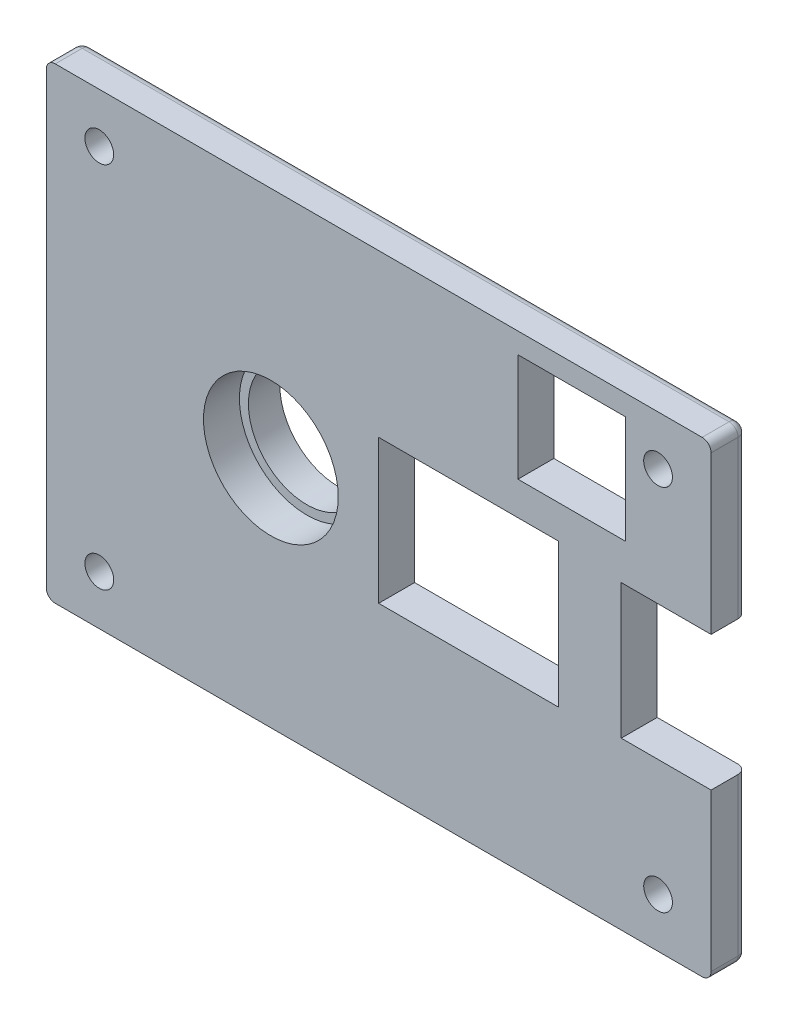
from build123d import *

# Parameters (mm, degrees)
ENCLOSURE_TOP_SKETCH_W          = 74
ENCLOSURE_TOP_SKETCH_H          = 52
ENCLOSURE_TOP_FEATURE_DEPTH     = 4
SCREW_HOLES_SKETCH_R            = 1.6
SCREW_HOLES_FEATURE_DEPTH       = 46.398237851
CAMERA_LIGHT_HOLE_SKETCH_R      = 7.5
CAMERA_LIGHT_HOLE_SKETCH_W      = 20
CAMERA_LIGHT_HOLE_SKETCH_H      = 16
CAMERA_LIGHT_HOLE_SKETCH_W_2    = 10
CAMERA_LIGHT_HOLE_SKETCH_H_2    = 15
CAMERA_LIGHT_HOLE_SKETCH_W_3    = 12
CAMERA_LIGHT_HOLE_SKETCH_H_3    = 12
CAMERA_LIGHT_HOLE_FEATURE_DEPTH = 46.398237851
FILTER_COVER_SKETCH_R           = 9
FILTER_COVER_FEATURE_DEPTH      = 3.5
FILTER_CUT_SKETCH_R             = 6.5
FILTER_CUT_DEPTH                = 3.5
FILLET1_R                       = 1
FILLET2_R                       = 1
FILLET3_R                       = 1
FILLET4_R                       = 1
FILLET5_R                       = 1
FILLET6_R                       = 1


with BuildPart() as part:
    # Enclosure Top Sketch → Enclosure Top Feature (new body)
    with BuildSketch(Plane.XY):
        Rectangle(ENCLOSURE_TOP_SKETCH_W, ENCLOSURE_TOP_SKETCH_H)
    extrude(amount=ENCLOSURE_TOP_FEATURE_DEPTH)

    # Screw Holes Sketch → Screw Holes Feature (cut, through all)
    with BuildSketch(Plane.XY.offset(4)):
        with Locations((-31.1, 20.5)):
            Circle(SCREW_HOLES_SKETCH_R)
        with Locations((31.096, 20.5)):
            Circle(SCREW_HOLES_SKETCH_R)
        with Locations((31.1, -20.5)):
            Circle(SCREW_HOLES_SKETCH_R)
        with Locations((-31.096, -20.5)):
            Circle(SCREW_HOLES_SKETCH_R)
    extrude(amount=-SCREW_HOLES_FEATURE_DEPTH, mode=Mode.SUBTRACT)

    # Camera + Light Hole Sketch → Camera _ Light Hole Feature (cut, through all)
    with BuildSketch(Plane.XY.offset(4)):
        with Locations((-12, 0)):
            Circle(CAMERA_LIGHT_HOLE_SKETCH_R)
        with Locations((10, 0)):
            Rectangle(CAMERA_LIGHT_HOLE_SKETCH_W, CAMERA_LIGHT_HOLE_SKETCH_H)
        with Locations((32, 0)):
            Rectangle(CAMERA_LIGHT_HOLE_SKETCH_W_2, CAMERA_LIGHT_HOLE_SKETCH_H_2)
        with Locations((21.5, 17.714)):
            Rectangle(CAMERA_LIGHT_HOLE_SKETCH_W_3, CAMERA_LIGHT_HOLE_SKETCH_H_3)
    extrude(amount=-CAMERA_LIGHT_HOLE_FEATURE_DEPTH, mode=Mode.SUBTRACT)

    # Filter Cover Sketch → Filter Cover Feature (add)
    with BuildSketch(Plane(origin=(0, 0, 0), x_dir=(-1, 0, 0), z_dir=(0, 0, -1))):
        with Locations(Location((12, 0, 0), (0, 0, 180))):
            Circle(FILTER_COVER_SKETCH_R)
    extrude(amount=FILTER_COVER_FEATURE_DEPTH)

    # Filter Cut Sketch → Filter Cut (cut)
    with BuildSketch(Plane(origin=(0, 0, -3.5), x_dir=(-1, 0, 0), z_dir=(0, 0, -1))):
        with Locations((12, 0)):
            Circle(FILTER_CUT_SKETCH_R)
    extrude(amount=-FILTER_CUT_DEPTH, mode=Mode.SUBTRACT)

    # Fillet1
    fillet1_edges = [part.edges().sort_by_distance(p)[0] for p in [
        (0, 26, 0),
    ]]
    fillet(fillet1_edges, radius=FILLET1_R)

    # Fillet2
    fillet2_edges = [part.edges().sort_by_distance(p)[0] for p in [
        (-37, -0.5, 0),
        (-37, 25.707106781, 0.292893219),
        (-37, 26, 2.5),
    ]]
    fillet(fillet2_edges, radius=FILLET2_R)

    # Fillet3
    fillet3_edges = [part.edges().sort_by_distance(p)[0] for p in [
        (0.5, -26, 0),
        (-36.707106781, -26, 0.292893219),
        (-37, -26, 2.5),
    ]]
    fillet(fillet3_edges, radius=FILLET3_R)

    # Fillet4
    fillet4_edges = [part.edges().sort_by_distance(p)[0] for p in [
        (37, -16.25, 0),
        (37, -25.707106781, 0.292893219),
        (37, -26, 2.5),
    ]]
    fillet(fillet4_edges, radius=FILLET4_R)

    # Fillet5
    fillet5_edges = [part.edges().sort_by_distance(p)[0] for p in [
        (37, 25.707106781, 0.292893219),
        (37, 16.25, 0),
        (37, 26, 2.5),
    ]]
    fillet(fillet5_edges, radius=FILLET5_R)

    # Fillet6
    fillet6_edges = [part.edges().sort_by_distance(p)[0] for p in [
        (-21, 0, -3.5),
    ]]
    fillet(fillet6_edges, radius=FILLET6_R)


solid = part.part
